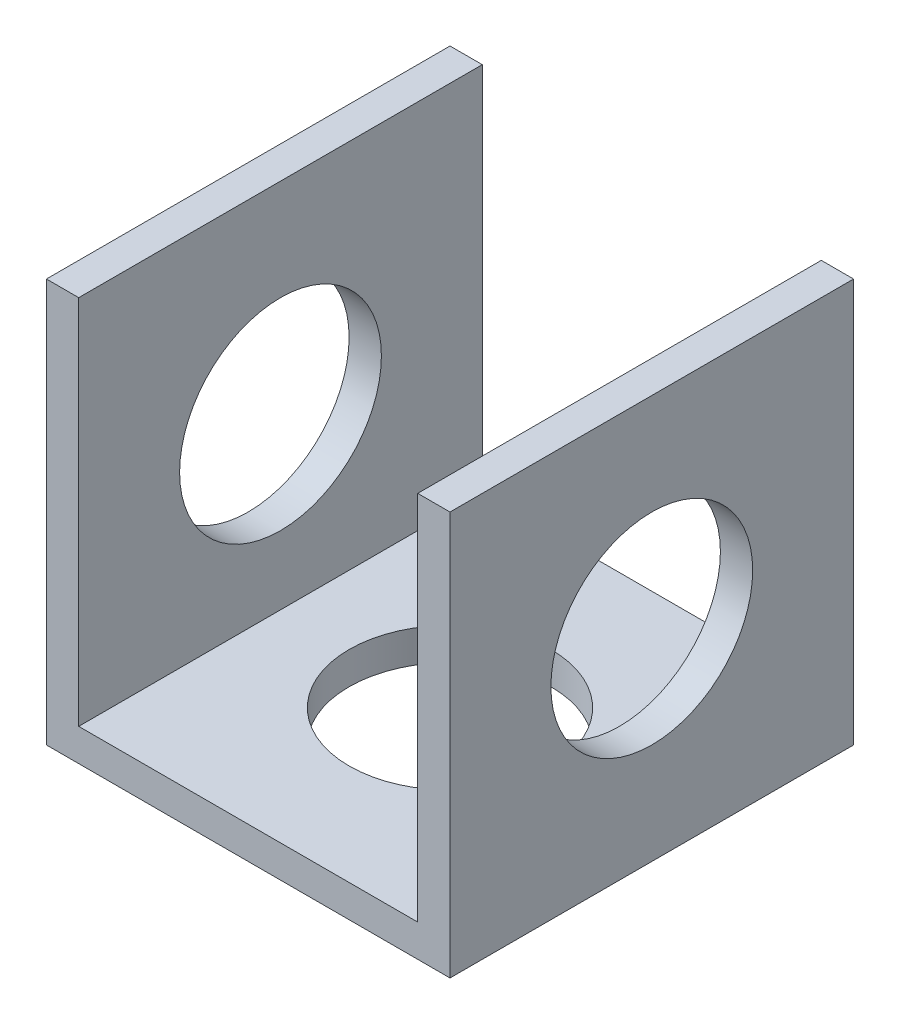
from build123d import *

# Parameters (mm, degrees)
SKETCH1_W                        = 6.35
SKETCH1_H                        = 6.35
BOSS_EXTRUDE1_DEPTH              = 6.35
F_1_8_0_125_DIAMETER_HOLE1_D     = 3.175
F_1_8_0_125_DIAMETER_HOLE1_DEPTH = 70.104
F_1_8_0_125_DIAMETER_HOLE1_TIP   = 0.953866233
SKETCH4_W                        = 5.334
SKETCH4_H                        = 5.842
CUT_EXTRUDE1_DEPTH               = 11.998522628
F_1_8_0_125_DIAMETER_HOLE2_D     = 3.175
F_1_8_0_125_DIAMETER_HOLE2_DEPTH = 70.104
F_1_8_0_125_DIAMETER_HOLE2_TIP   = 0.953866233


with BuildPart() as part:
    # Sketch1 → Boss-Extrude1 (new body)
    with BuildSketch(Plane(origin=(0, 0, 0), x_dir=(0, 0, -1), z_dir=(1, 0, 0))):
        with Locations((3.175, 3.175)):
            Rectangle(SKETCH1_W, SKETCH1_H)
    extrude(amount=BOSS_EXTRUDE1_DEPTH)

    # 1/8 (0.125) Diameter Hole1
    with Locations(Plane(origin=(6.35, 0, 0), x_dir=(0, 0, -1), z_dir=(1, 0, 0))):
        with Locations((3.175, 3.175)):
            Hole(F_1_8_0_125_DIAMETER_HOLE1_D / 2, depth=F_1_8_0_125_DIAMETER_HOLE1_DEPTH)
            with Locations((0, 0, -(F_1_8_0_125_DIAMETER_HOLE1_DEPTH + F_1_8_0_125_DIAMETER_HOLE1_TIP / 2))):  # 118° drill point
                Cone(0, F_1_8_0_125_DIAMETER_HOLE1_D / 2, F_1_8_0_125_DIAMETER_HOLE1_TIP, mode=Mode.SUBTRACT)

    # Sketch4 → Cut-Extrude1 (cut, through all)
    with BuildSketch(Plane(origin=(0, 0, -6.35), x_dir=(-1, 0, 0), z_dir=(0, 0, -1))):
        with Locations((-3.175, 3.429)):
            Rectangle(SKETCH4_W, SKETCH4_H)
    extrude(amount=-CUT_EXTRUDE1_DEPTH, mode=Mode.SUBTRACT)

    # 1/8 (0.125) Diameter Hole2
    with Locations(Plane(origin=(0, 0, 0), x_dir=(-1, 0, 0), z_dir=(0, -1, 0))):
        with Locations((-3.175, 3.175)):
            Hole(F_1_8_0_125_DIAMETER_HOLE2_D / 2, depth=F_1_8_0_125_DIAMETER_HOLE2_DEPTH)
            with Locations((0, 0, -(F_1_8_0_125_DIAMETER_HOLE2_DEPTH + F_1_8_0_125_DIAMETER_HOLE2_TIP / 2))):  # 118° drill point
                Cone(0, F_1_8_0_125_DIAMETER_HOLE2_D / 2, F_1_8_0_125_DIAMETER_HOLE2_TIP, mode=Mode.SUBTRACT)


solid = part.part
